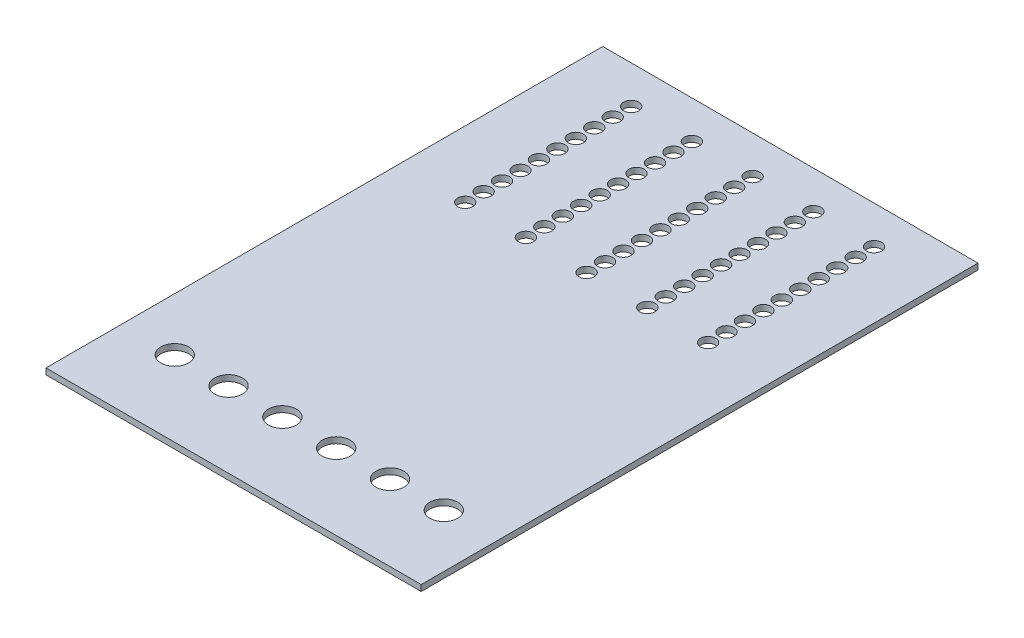
from build123d import *

# Parameters (mm, degrees)
SKETCH1_W           = 124
SKETCH1_H           = 184
SKETCH1_R           = 2.5
BOSS_EXTRUDE1_DEPTH = 2
CUT_EXTRUDE2_REACH  = 112.959
SKETCH5_R           = 4.6


with BuildPart() as part:
    # Sketch1 → Boss-Extrude1 (new body)
    with BuildSketch(Plane(origin=(0, 60, 0), x_dir=(1, 0, 0), z_dir=(0, 1, 0))):
        Rectangle(SKETCH1_W, SKETCH1_H)
        with Locations(Location((-40.132, 79.51715957, 0), (0, 0, 270))):
            Circle(SKETCH1_R, mode=Mode.SUBTRACT)
        with Locations(Location((-20.066, 79.51715957, 0), (0, 0, 270))):
            Circle(SKETCH1_R, mode=Mode.SUBTRACT)
        with Locations(Location((0, 79.51715957, 0), (0, 0, 270))):
            Circle(SKETCH1_R, mode=Mode.SUBTRACT)
        with Locations(Location((20.066, 79.51715957, 0), (0, 0, 270))):
            Circle(SKETCH1_R, mode=Mode.SUBTRACT)
        with Locations(Location((40.132, 79.51715957, 0), (0, 0, 270))):
            Circle(SKETCH1_R, mode=Mode.SUBTRACT)
        with Locations(Location((-20.066, 73.42115957, 0), (0, 0, 270))):
            Circle(SKETCH1_R, mode=Mode.SUBTRACT)
        with Locations(Location((0, 73.42115957, 0), (0, 0, 270))):
            Circle(SKETCH1_R, mode=Mode.SUBTRACT)
        with Locations(Location((20.066, 73.42115957, 0), (0, 0, 270))):
            Circle(SKETCH1_R, mode=Mode.SUBTRACT)
        with Locations(Location((40.132, 73.42115957, 0), (0, 0, 270))):
            Circle(SKETCH1_R, mode=Mode.SUBTRACT)
        with Locations(Location((-20.066, 67.32515957, 0), (0, 0, 270))):
            Circle(SKETCH1_R, mode=Mode.SUBTRACT)
        with Locations(Location((0, 67.32515957, 0), (0, 0, 270))):
            Circle(SKETCH1_R, mode=Mode.SUBTRACT)
        with Locations(Location((20.066, 67.32515957, 0), (0, 0, 270))):
            Circle(SKETCH1_R, mode=Mode.SUBTRACT)
        with Locations(Location((40.132, 67.32515957, 0), (0, 0, 270))):
            Circle(SKETCH1_R, mode=Mode.SUBTRACT)
        with Locations(Location((-20.066, 61.22915957, 0), (0, 0, 270))):
            Circle(SKETCH1_R, mode=Mode.SUBTRACT)
        with Locations(Location((0, 61.22915957, 0), (0, 0, 270))):
            Circle(SKETCH1_R, mode=Mode.SUBTRACT)
        with Locations(Location((20.066, 61.22915957, 0), (0, 0, 270))):
            Circle(SKETCH1_R, mode=Mode.SUBTRACT)
        with Locations(Location((40.132, 61.22915957, 0), (0, 0, 270))):
            Circle(SKETCH1_R, mode=Mode.SUBTRACT)
        with Locations(Location((-20.066, 55.13315957, 0), (0, 0, 270))):
            Circle(SKETCH1_R, mode=Mode.SUBTRACT)
        with Locations(Location((0, 55.13315957, 0), (0, 0, 270))):
            Circle(SKETCH1_R, mode=Mode.SUBTRACT)
        with Locations(Location((20.066, 55.13315957, 0), (0, 0, 270))):
            Circle(SKETCH1_R, mode=Mode.SUBTRACT)
        with Locations(Location((40.132, 55.13315957, 0), (0, 0, 270))):
            Circle(SKETCH1_R, mode=Mode.SUBTRACT)
        with Locations(Location((-20.066, 49.03715957, 0), (0, 0, 270))):
            Circle(SKETCH1_R, mode=Mode.SUBTRACT)
        with Locations(Location((0, 49.03715957, 0), (0, 0, 270))):
            Circle(SKETCH1_R, mode=Mode.SUBTRACT)
        with Locations(Location((20.066, 49.03715957, 0), (0, 0, 270))):
            Circle(SKETCH1_R, mode=Mode.SUBTRACT)
        with Locations(Location((40.132, 49.03715957, 0), (0, 0, 270))):
            Circle(SKETCH1_R, mode=Mode.SUBTRACT)
        with Locations(Location((-20.066, 42.94115957, 0), (0, 0, 270))):
            Circle(SKETCH1_R, mode=Mode.SUBTRACT)
        with Locations(Location((0, 42.94115957, 0), (0, 0, 270))):
            Circle(SKETCH1_R, mode=Mode.SUBTRACT)
        with Locations(Location((20.066, 42.94115957, 0), (0, 0, 270))):
            Circle(SKETCH1_R, mode=Mode.SUBTRACT)
        with Locations(Location((40.132, 42.94115957, 0), (0, 0, 270))):
            Circle(SKETCH1_R, mode=Mode.SUBTRACT)
        with Locations(Location((-20.066, 36.84515957, 0), (0, 0, 270))):
            Circle(SKETCH1_R, mode=Mode.SUBTRACT)
        with Locations(Location((0, 36.84515957, 0), (0, 0, 270))):
            Circle(SKETCH1_R, mode=Mode.SUBTRACT)
        with Locations(Location((20.066, 36.84515957, 0), (0, 0, 270))):
            Circle(SKETCH1_R, mode=Mode.SUBTRACT)
        with Locations(Location((40.132, 36.84515957, 0), (0, 0, 270))):
            Circle(SKETCH1_R, mode=Mode.SUBTRACT)
        with Locations(Location((-20.066, 30.74915957, 0), (0, 0, 270))):
            Circle(SKETCH1_R, mode=Mode.SUBTRACT)
        with Locations(Location((0, 30.74915957, 0), (0, 0, 270))):
            Circle(SKETCH1_R, mode=Mode.SUBTRACT)
        with Locations(Location((20.066, 30.74915957, 0), (0, 0, 270))):
            Circle(SKETCH1_R, mode=Mode.SUBTRACT)
        with Locations(Location((40.132, 30.74915957, 0), (0, 0, 270))):
            Circle(SKETCH1_R, mode=Mode.SUBTRACT)
        with Locations(Location((-20.066, 24.65315957, 0), (0, 0, 270))):
            Circle(SKETCH1_R, mode=Mode.SUBTRACT)
        with Locations(Location((0, 24.65315957, 0), (0, 0, 270))):
            Circle(SKETCH1_R, mode=Mode.SUBTRACT)
        with Locations(Location((20.066, 24.65315957, 0), (0, 0, 270))):
            Circle(SKETCH1_R, mode=Mode.SUBTRACT)
        with Locations(Location((40.132, 24.65315957, 0), (0, 0, 270))):
            Circle(SKETCH1_R, mode=Mode.SUBTRACT)
        with Locations(Location((-40.132, 73.42115957, 0), (0, 0, 270))):
            Circle(SKETCH1_R, mode=Mode.SUBTRACT)
        with Locations(Location((-40.132, 67.32515957, 0), (0, 0, 270))):
            Circle(SKETCH1_R, mode=Mode.SUBTRACT)
        with Locations(Location((-40.132, 61.22915957, 0), (0, 0, 270))):
            Circle(SKETCH1_R, mode=Mode.SUBTRACT)
        with Locations(Location((-40.132, 55.13315957, 0), (0, 0, 270))):
            Circle(SKETCH1_R, mode=Mode.SUBTRACT)
        with Locations(Location((-40.132, 49.03715957, 0), (0, 0, 270))):
            Circle(SKETCH1_R, mode=Mode.SUBTRACT)
        with Locations(Location((-40.132, 42.94115957, 0), (0, 0, 270))):
            Circle(SKETCH1_R, mode=Mode.SUBTRACT)
        with Locations(Location((-40.132, 36.84515957, 0), (0, 0, 270))):
            Circle(SKETCH1_R, mode=Mode.SUBTRACT)
        with Locations(Location((-40.132, 30.74915957, 0), (0, 0, 270))):
            Circle(SKETCH1_R, mode=Mode.SUBTRACT)
        with Locations(Location((-40.132, 24.65315957, 0), (0, 0, 270))):
            Circle(SKETCH1_R, mode=Mode.SUBTRACT)
    extrude(amount=BOSS_EXTRUDE1_DEPTH)

    # Sketch5 → Cut-Extrude2 (cut, up to next)
    with BuildSketch(Plane(origin=(0, 62, 0), x_dir=(1, 0, 0), z_dir=(0, 1, 0)), mode=Mode.PRIVATE) as cut_extrude2_sk1:
        with Locations(Location((-44.45, -67, 0), (0, 0, 270))):
            Circle(SKETCH5_R)
    cut_extrude2_tool1 = extrude(cut_extrude2_sk1.sketch, amount=-CUT_EXTRUDE2_REACH, mode=Mode.PRIVATE) & part.part
    # Sketch5 → Cut-Extrude2 (cut, up to next)
    with BuildSketch(Plane(origin=(0, 62, 0), x_dir=(1, 0, 0), z_dir=(0, 1, 0)), mode=Mode.PRIVATE) as cut_extrude2_sk2:
        with Locations(Location((-26.67, -67, 0), (0, 0, 270))):
            Circle(SKETCH5_R)
    cut_extrude2_tool2 = extrude(cut_extrude2_sk2.sketch, amount=-CUT_EXTRUDE2_REACH, mode=Mode.PRIVATE) & part.part
    # Sketch5 → Cut-Extrude2 (cut, up to next)
    with BuildSketch(Plane(origin=(0, 62, 0), x_dir=(1, 0, 0), z_dir=(0, 1, 0)), mode=Mode.PRIVATE) as cut_extrude2_sk3:
        with Locations(Location((-8.89, -67, 0), (0, 0, 270))):
            Circle(SKETCH5_R)
    cut_extrude2_tool3 = extrude(cut_extrude2_sk3.sketch, amount=-CUT_EXTRUDE2_REACH, mode=Mode.PRIVATE) & part.part
    # Sketch5 → Cut-Extrude2 (cut, up to next)
    with BuildSketch(Plane(origin=(0, 62, 0), x_dir=(1, 0, 0), z_dir=(0, 1, 0)), mode=Mode.PRIVATE) as cut_extrude2_sk4:
        with Locations(Location((8.89, -67, 0), (0, 0, 270))):
            Circle(SKETCH5_R)
    cut_extrude2_tool4 = extrude(cut_extrude2_sk4.sketch, amount=-CUT_EXTRUDE2_REACH, mode=Mode.PRIVATE) & part.part
    # Sketch5 → Cut-Extrude2 (cut, up to next)
    with BuildSketch(Plane(origin=(0, 62, 0), x_dir=(1, 0, 0), z_dir=(0, 1, 0)), mode=Mode.PRIVATE) as cut_extrude2_sk5:
        with Locations(Location((26.67, -67, 0), (0, 0, 270))):
            Circle(SKETCH5_R)
    cut_extrude2_tool5 = extrude(cut_extrude2_sk5.sketch, amount=-CUT_EXTRUDE2_REACH, mode=Mode.PRIVATE) & part.part
    # Sketch5 → Cut-Extrude2 (cut, up to next)
    with BuildSketch(Plane(origin=(0, 62, 0), x_dir=(1, 0, 0), z_dir=(0, 1, 0)), mode=Mode.PRIVATE) as cut_extrude2_sk6:
        with Locations(Location((44.45, -67, 0), (0, 0, 270))):
            Circle(SKETCH5_R)
    cut_extrude2_tool6 = extrude(cut_extrude2_sk6.sketch, amount=-CUT_EXTRUDE2_REACH, mode=Mode.PRIVATE) & part.part
    add(cut_extrude2_tool1.solids().sort_by_distance((-44.45, 62, 67))[0], mode=Mode.SUBTRACT)
    add(cut_extrude2_tool2.solids().sort_by_distance((-26.67, 62, 67))[0], mode=Mode.SUBTRACT)
    add(cut_extrude2_tool3.solids().sort_by_distance((-8.89, 62, 67))[0], mode=Mode.SUBTRACT)
    add(cut_extrude2_tool4.solids().sort_by_distance((8.89, 62, 67))[0], mode=Mode.SUBTRACT)
    add(cut_extrude2_tool5.solids().sort_by_distance((26.67, 62, 67))[0], mode=Mode.SUBTRACT)
    add(cut_extrude2_tool6.solids().sort_by_distance((44.45, 62, 67))[0], mode=Mode.SUBTRACT)


solid = part.part
